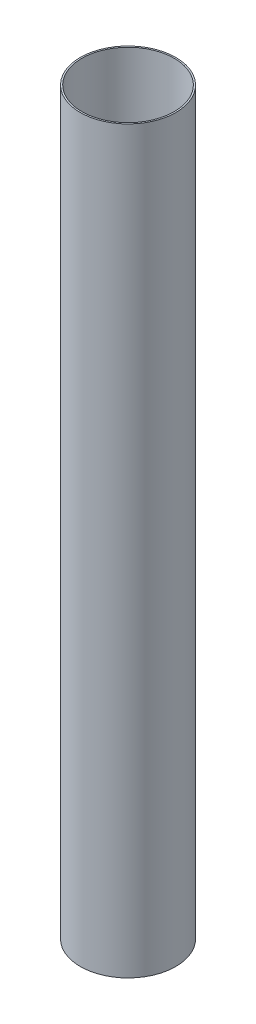
from build123d import *

# Parameters (mm, degrees)
SKETCH2_R           = 39.37
SKETCH2_R_2         = 38.1
BOSS_EXTRUDE1_DEPTH = 609.6


with BuildPart() as part:
    # Sketch2 → Boss-Extrude1 (new body)
    with BuildSketch(Plane(origin=(0, 0, 0), x_dir=(1, 0, 0), z_dir=(0, 1, 0))):
        Circle(SKETCH2_R)
        Circle(SKETCH2_R_2, mode=Mode.SUBTRACT)
    extrude(amount=BOSS_EXTRUDE1_DEPTH)


solid = part.part
